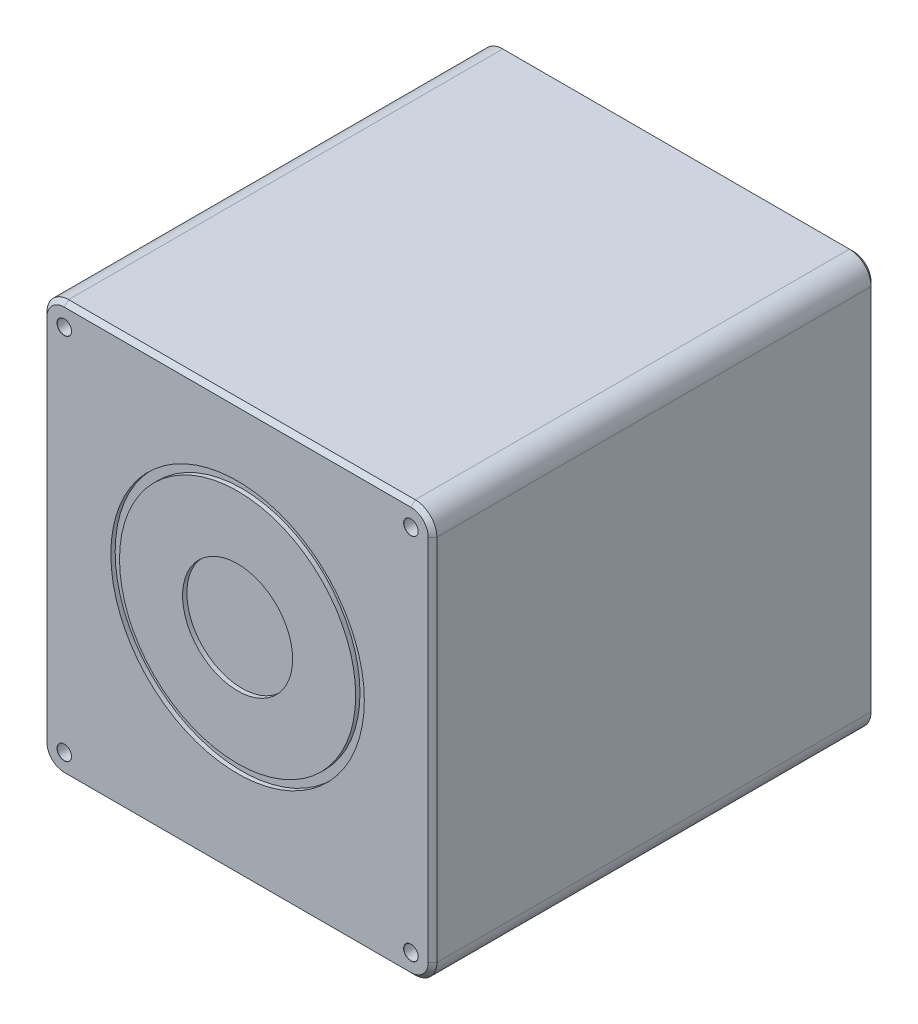
from build123d import *

# Parameters (mm, degrees)
SKETCH1_W                             = 90
SKETCH1_H                             = 95
BOSS_EXTRUDE1_DEPTH                   = 102.2
SKETCH2_R                             = 29.25
CUT_EXTRUDE1_DEPTH                    = 1
SKETCH3_R                             = 27.25
BOSS_EXTRUDE2_DEPTH                   = 1
TAP_DRILL_FOR_M4_TAP1_D               = 3.3
TAP_DRILL_FOR_M4_TAP1_DEPTH           = 5
TAP_DRILL_FOR_M4_TAP1_CSINK_D         = 3.35
TAP_DRILL_FOR_M4_TAP1_CSINK_ANGLE     = 90
TAP_DRILL_FOR_M4_TAP1_TIP             = 0.991420021
TAP_DRILL_FOR_M4_TAP2_D               = 3.3
TAP_DRILL_FOR_M4_TAP2_DEPTH           = 5
TAP_DRILL_FOR_M4_TAP2_CSINK_D         = 3.35
TAP_DRILL_FOR_M4_TAP2_CSINK_ANGLE     = 90
TAP_DRILL_FOR_M4_TAP2_TIP             = 0.991420021
TAP_DRILL_FOR_1_4_20_TAP1_D           = 5.1054
TAP_DRILL_FOR_1_4_20_TAP1_DEPTH       = 5
TAP_DRILL_FOR_1_4_20_TAP1_CSINK_D     = 6.3754
TAP_DRILL_FOR_1_4_20_TAP1_CSINK_ANGLE = 90
TAP_DRILL_FOR_1_4_20_TAP1_TIP         = 1.533816902
FILLET1_R                             = 5
CHAMFER1_SIZE                         = 1
SKETCH13_R                            = 12.7
CUT_EXTRUDE2_DEPTH                    = 1


with BuildPart() as part:
    # Sketch1 → Boss-Extrude1 (new body)
    with BuildSketch(Plane.XY):
        Rectangle(SKETCH1_W, SKETCH1_H)
    extrude(amount=-BOSS_EXTRUDE1_DEPTH)

    # Sketch2 → Cut-Extrude1 (cut)
    with BuildSketch(Plane.XY):
        with Locations((0, 2.5)):
            Circle(SKETCH2_R)
    extrude(amount=-CUT_EXTRUDE1_DEPTH, mode=Mode.SUBTRACT)

    # Sketch3 → Boss-Extrude2 (add)
    with BuildSketch(Plane.XY.offset(-1)):
        with Locations((0, 2.5)):
            Circle(SKETCH3_R)
    extrude(amount=BOSS_EXTRUDE2_DEPTH)

    # Tap Drill for M4 Tap1
    with Locations(Plane.XY):
        with Locations((-40, 42.5), (40, 42.5), (-40, -42.5), (40, -42.5)):
            CounterSinkHole(TAP_DRILL_FOR_M4_TAP1_D / 2, TAP_DRILL_FOR_M4_TAP1_CSINK_D / 2, depth=TAP_DRILL_FOR_M4_TAP1_DEPTH, counter_sink_angle=TAP_DRILL_FOR_M4_TAP1_CSINK_ANGLE)
            with Locations((0, 0, -(TAP_DRILL_FOR_M4_TAP1_DEPTH + TAP_DRILL_FOR_M4_TAP1_TIP / 2))):  # 118° drill point
                Cone(0, TAP_DRILL_FOR_M4_TAP1_D / 2, TAP_DRILL_FOR_M4_TAP1_TIP, mode=Mode.SUBTRACT)

    # Tap Drill for M4 Tap2
    with Locations(Plane(origin=(0, -47.5, 0), x_dir=(-1, 0, 0), z_dir=(0, -1, 0))):
        with Locations((-30, 83.9), (30, 83.9)):
            CounterSinkHole(TAP_DRILL_FOR_M4_TAP2_D / 2, TAP_DRILL_FOR_M4_TAP2_CSINK_D / 2, depth=TAP_DRILL_FOR_M4_TAP2_DEPTH, counter_sink_angle=TAP_DRILL_FOR_M4_TAP2_CSINK_ANGLE)
            with Locations((0, 0, -(TAP_DRILL_FOR_M4_TAP2_DEPTH + TAP_DRILL_FOR_M4_TAP2_TIP / 2))):  # 118° drill point
                Cone(0, TAP_DRILL_FOR_M4_TAP2_D / 2, TAP_DRILL_FOR_M4_TAP2_TIP, mode=Mode.SUBTRACT)

    # Tap Drill for 1/4-20 Tap1
    with Locations(Plane(origin=(0, -47.5, 0), x_dir=(-1, 0, 0), z_dir=(0, -1, 0))):
        with Locations((0, 48.9)):
            CounterSinkHole(TAP_DRILL_FOR_1_4_20_TAP1_D / 2, TAP_DRILL_FOR_1_4_20_TAP1_CSINK_D / 2, depth=TAP_DRILL_FOR_1_4_20_TAP1_DEPTH, counter_sink_angle=TAP_DRILL_FOR_1_4_20_TAP1_CSINK_ANGLE)
            with Locations((0, 0, -(TAP_DRILL_FOR_1_4_20_TAP1_DEPTH + TAP_DRILL_FOR_1_4_20_TAP1_TIP / 2))):  # 118° drill point
                Cone(0, TAP_DRILL_FOR_1_4_20_TAP1_D / 2, TAP_DRILL_FOR_1_4_20_TAP1_TIP, mode=Mode.SUBTRACT)

    # Fillet1
    fillet1_edges = [part.edges().sort_by_distance(p)[0] for p in [
        (45, -47.5, -51.1),
        (-45, -47.5, -51.1),
        (-45, 47.5, -51.1),
        (45, 47.5, -51.1),
    ]]
    fillet(fillet1_edges, radius=FILLET1_R)

    # Chamfer1
    chamfer1_edges = [part.edges().sort_by_distance(p)[0] for p in [
        (0, -47.5, 0),
        (0, -47.5, -102.2),
        (45, 0, 0),
        (0, 47.5, 0),
        (-45, 0, 0),
        (43.535533906, 46.035533906, 0),
        (-43.535533906, 46.035533906, 0),
        (-43.535533906, -46.035533906, 0),
        (43.535533906, -46.035533906, 0),
        (45, 0, -102.2),
        (-45, 0, -102.2),
        (0, 47.5, -102.2),
        (43.535533906, 46.035533906, -102.2),
        (-43.535533906, 46.035533906, -102.2),
        (-43.535533906, -46.035533906, -102.2),
        (43.535533906, -46.035533906, -102.2),
    ]]
    chamfer(chamfer1_edges, length=CHAMFER1_SIZE)

    # Sketch13 → Cut-Extrude2 (cut)
    with BuildSketch(Plane.XY):
        with Locations((0, 2.5)):
            Circle(SKETCH13_R)
    extrude(amount=-CUT_EXTRUDE2_DEPTH, mode=Mode.SUBTRACT)


solid = part.part
